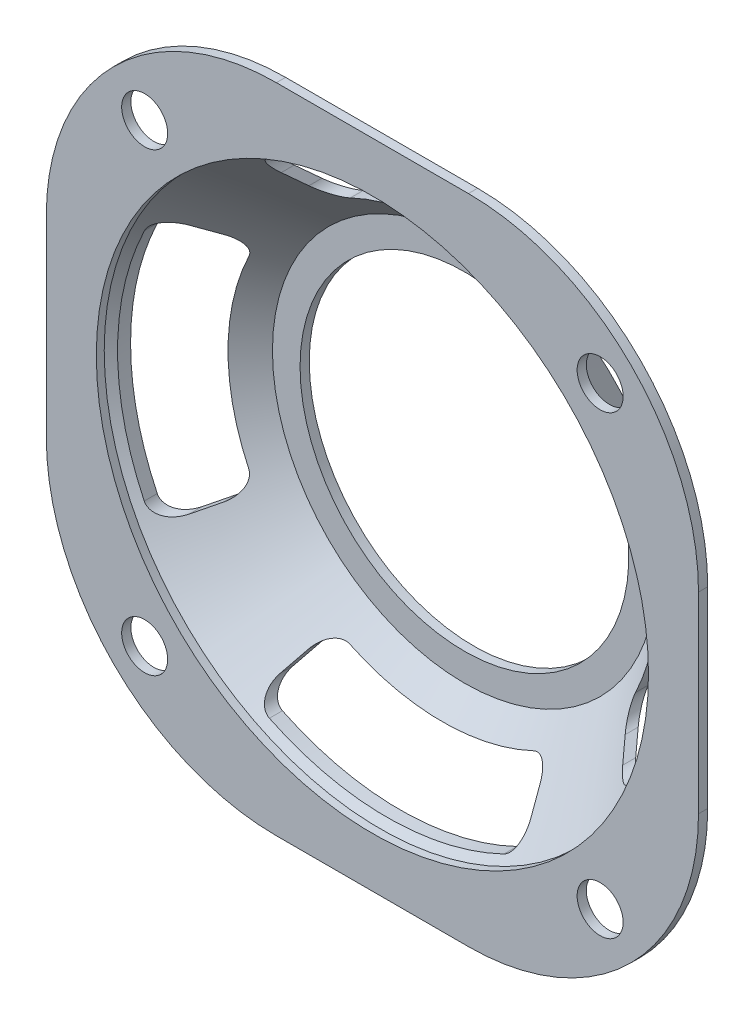
from build123d import *

# Parameters (mm, degrees)
SKETCH_1_R               = 2.5
SKETCH_1_R_2             = 30
EXTRUDE_1_DEPTH          = 1
CUT_EXTRUDE_1_DEPTH      = 52.098751802
PATTERN_CIRCULAR_1_COUNT = 4


with BuildPart() as part:
    # 草圖1 → 填料-伸長1 (new body)
    with BuildSketch(Plane.XY):
        with BuildLine():
            Line((-35.433617059, -10.433617059), (-35.433617059, 10.433617059))
            ThreePointArc((-35.433617059, 10.433617059), (-28.111286589, 28.111286589), (-10.433617059, 35.433617059))
            Line((-10.433617059, 35.433617059), (10.433617059, 35.433617059))
            ThreePointArc((10.433617059, 35.433617059), (28.111286589, 28.111286589), (35.433617059, 10.433617059))
            Line((35.433617059, 10.433617059), (35.433617059, -10.433617059))
            ThreePointArc((35.433617059, -10.433617059), (28.111286589, -28.111286589), (10.433617059, -35.433617059))
            Line((10.433617059, -35.433617059), (-10.433617059, -35.433617059))
            ThreePointArc((-10.433617059, -35.433617059), (-28.111286589, -28.111286589), (-35.433617059, -10.433617059))
        make_face()
        with Locations((-24.745, 24.745)):
            Circle(SKETCH_1_R, mode=Mode.SUBTRACT)
        with Locations((24.745, 24.745)):
            Circle(SKETCH_1_R, mode=Mode.SUBTRACT)
        with Locations((24.745, -24.745)):
            Circle(SKETCH_1_R, mode=Mode.SUBTRACT)
        with Locations((-24.745, -24.745)):
            Circle(SKETCH_1_R, mode=Mode.SUBTRACT)
        Circle(SKETCH_1_R_2, mode=Mode.SUBTRACT)
    extrude(amount=EXTRUDE_1_DEPTH)

    # 草圖2 → 旋轉-薄件1 (revolve)
    with BuildSketch(Plane(origin=(0, 0, 0), x_dir=(0, 0, -1), z_dir=(1, 0, 0)), mode=Mode.PRIVATE) as revolve_1_sk:
        Polygon((9, 17.860241504), (9, 20.860241504), (-1, 30.860241504), (-0.292893219, 31.567348285), (10, 21.274455066), (10, 17.860241504), align=None)
    revolve(revolve_1_sk.sketch.rotate(Axis((0, 0, -24.578142598), (0, 0, 1)), 270), axis=Axis((0, 0, -24.578142598), (0, 0, 1)))

    # 草圖3 → 除料-伸長1 (cut, through all)
    with BuildSketch(Plane.XY):
        with BuildLine():
            Line((-23.537208202, 13.634358409), (-21.801553488, 12.628948667))
            ThreePointArc((-21.801553488, 12.628948667), (-20.893350738, 11.48931837), (-20.999528922, 10.035937608))
            ThreePointArc((-20.999528922, 10.035937608), (-23.274431025, 0.033452896), (-21.028291883, -9.975530017))
            ThreePointArc((-21.028291883, -9.975530017), (-20.926292086, -11.429209999), (-21.837767112, -12.566224829))
            Line((-21.837767112, -12.566224829), (-23.576304848, -13.566641032))
            ThreePointArc((-23.576304848, -13.566641032), (-25.164728592, -13.743866678), (-26.375779856, -12.700864397))
            ThreePointArc((-26.375779856, -12.700864397), (-29.274424827, 0.04207683), (-26.33916044, 12.77663284))
            ThreePointArc((-26.33916044, 12.77663284), (-25.125115923, 13.816149473), (-23.537208202, 13.634358409))
        make_face()
    cut_extrude_1 = extrude(amount=-CUT_EXTRUDE_1_DEPTH, mode=Mode.SUBTRACT)

    # 環狀複製排列1: 除料-伸長1 ×4 about axis
    pattern_circular_1_axis = Axis((0, 0, 0), (0, 0, 1))
    for i in range(1, PATTERN_CIRCULAR_1_COUNT):
        add(cut_extrude_1.rotate(pattern_circular_1_axis, i * 360 / PATTERN_CIRCULAR_1_COUNT), mode=Mode.SUBTRACT)


solid = part.part
